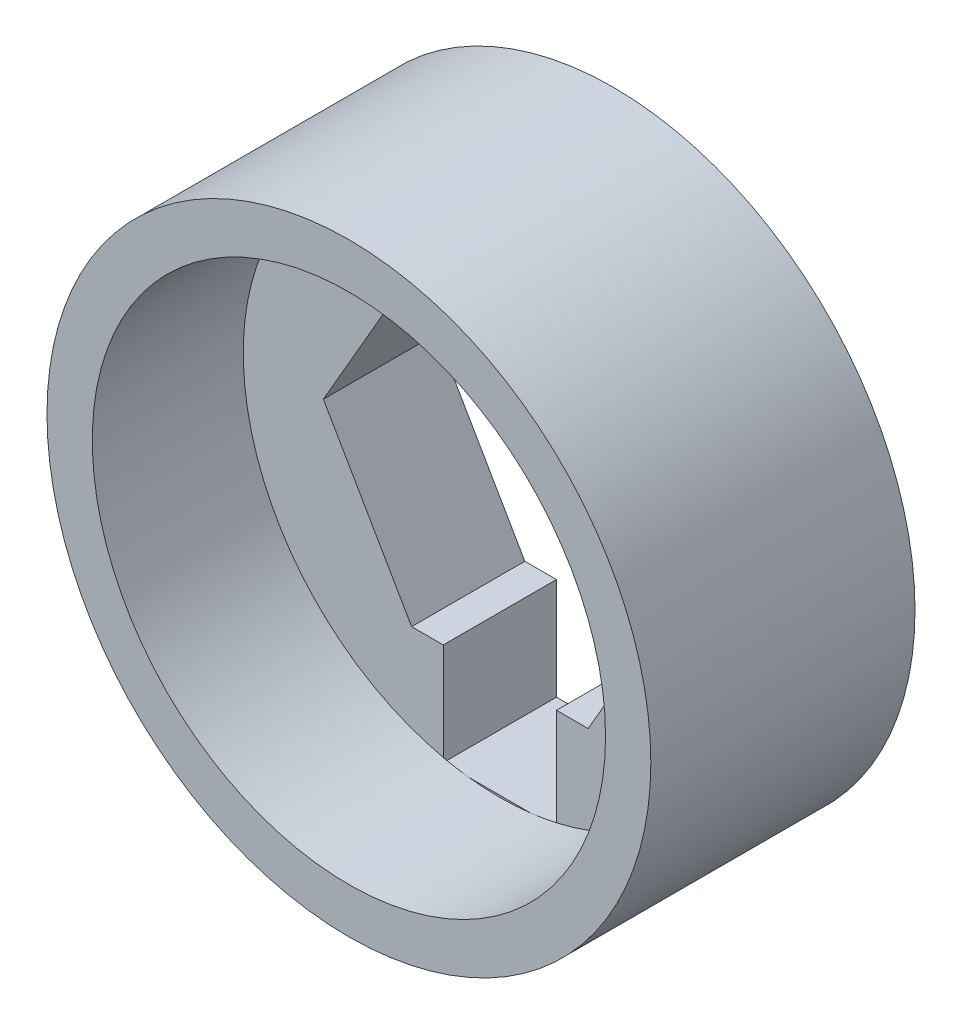
from build123d import *

# Parameters (mm, degrees)
SKETCH1_R           = 8
BOSS_EXTRUDE1_DEPTH = 7
SKETCH2_R           = 6.8
CUT_EXTRUDE1_DEPTH  = 4
CUT_EXTRUDE2_DEPTH  = 4
SKETCH5_W           = 3
SKETCH5_H           = 3
CUT_EXTRUDE4_DEPTH  = 13


with BuildPart() as part:
    # Sketch1 → Boss-Extrude1 (new body)
    with BuildSketch(Plane.XY):
        with Locations(Location((0, 0, 0), (0, 0, 180))):
            Circle(SKETCH1_R)
    extrude(amount=BOSS_EXTRUDE1_DEPTH)

    # Sketch2 → Cut-Extrude1 (cut)
    with BuildSketch(Plane.XY.offset(7)):
        Circle(SKETCH2_R)
    extrude(amount=-CUT_EXTRUDE1_DEPTH, mode=Mode.SUBTRACT)

    # Sketch3 → Cut-Extrude2 (cut)
    with BuildSketch(Plane.XY):
        Polygon((4.67653718, 0), (2.33826859, 4.05), (-2.33826859, 4.05), (-4.67653718, 0), (-2.33826859, -4.05), (2.33826859, -4.05), align=None)
    extrude(amount=CUT_EXTRUDE2_DEPTH, mode=Mode.SUBTRACT)

    # Sketch5 → Cut-Extrude4 (cut, through all)
    with BuildSketch(Plane.XY.offset(3)):
        with Locations((0, 5.25)):
            Rectangle(SKETCH5_W, SKETCH5_H)
        with Locations((0, -5.25)):
            Rectangle(SKETCH5_W, SKETCH5_H)
    extrude(amount=-CUT_EXTRUDE4_DEPTH, mode=Mode.SUBTRACT)


solid = part.part
